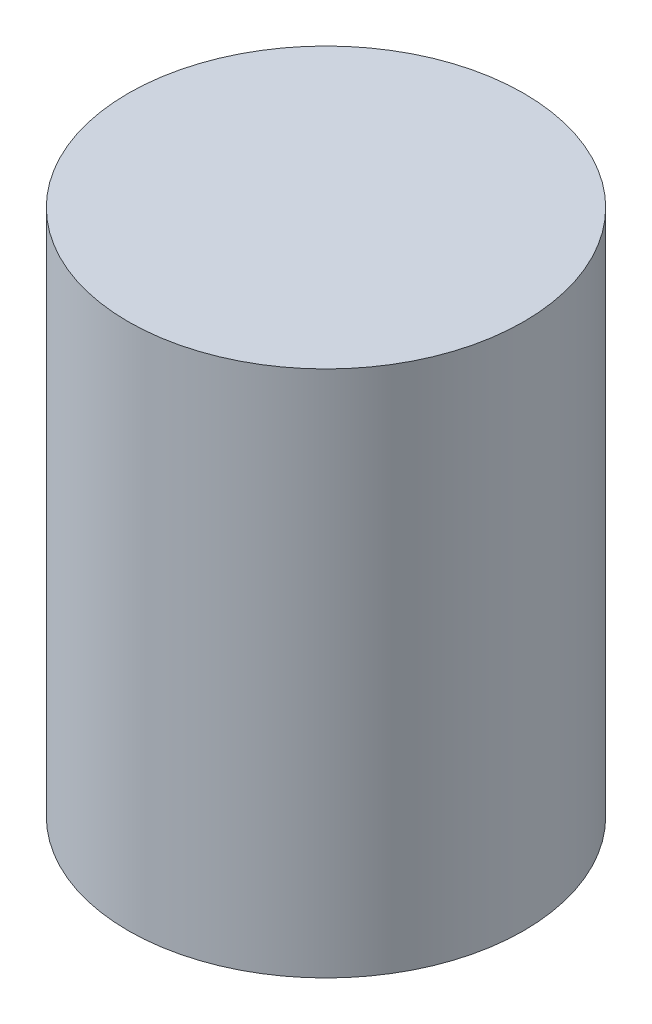
from build123d import *

# Parameters (mm, degrees)
SKETCH_1_R      = 15
EXTRUDE_1_DEPTH = 40


with BuildPart() as part:
    # 草图1 → 凸台-拉伸1 (new body)
    with BuildSketch(Plane(origin=(0, 0, 0), x_dir=(1, 0, 0), z_dir=(0, 1, 0))):
        with Locations(Location((0, 0, 0), (0, 0, 270))):
            Circle(SKETCH_1_R)
    extrude(amount=EXTRUDE_1_DEPTH)


solid = part.part
